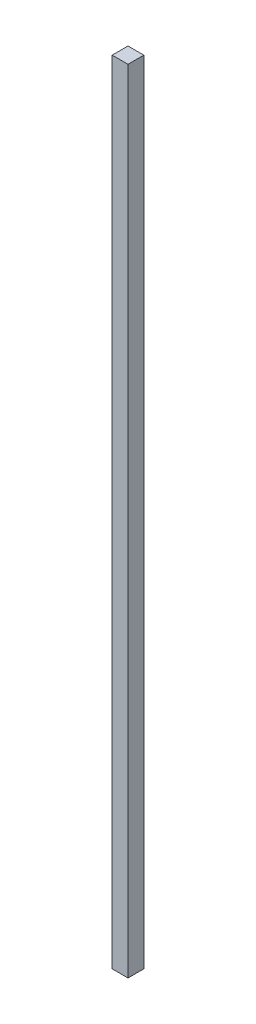
from build123d import *

# Parameters (mm, degrees)
SKETCH1_W           = 20
SKETCH1_H           = 20
BOSS_EXTRUDE1_DEPTH = 1000


with BuildPart() as part:
    # Sketch1 → Boss-Extrude1 (new body)
    with BuildSketch(Plane(origin=(0, 0, 0), x_dir=(1, 0, 0), z_dir=(0, 1, 0))):
        Rectangle(SKETCH1_W, SKETCH1_H)
    extrude(amount=BOSS_EXTRUDE1_DEPTH)


solid = part.part
